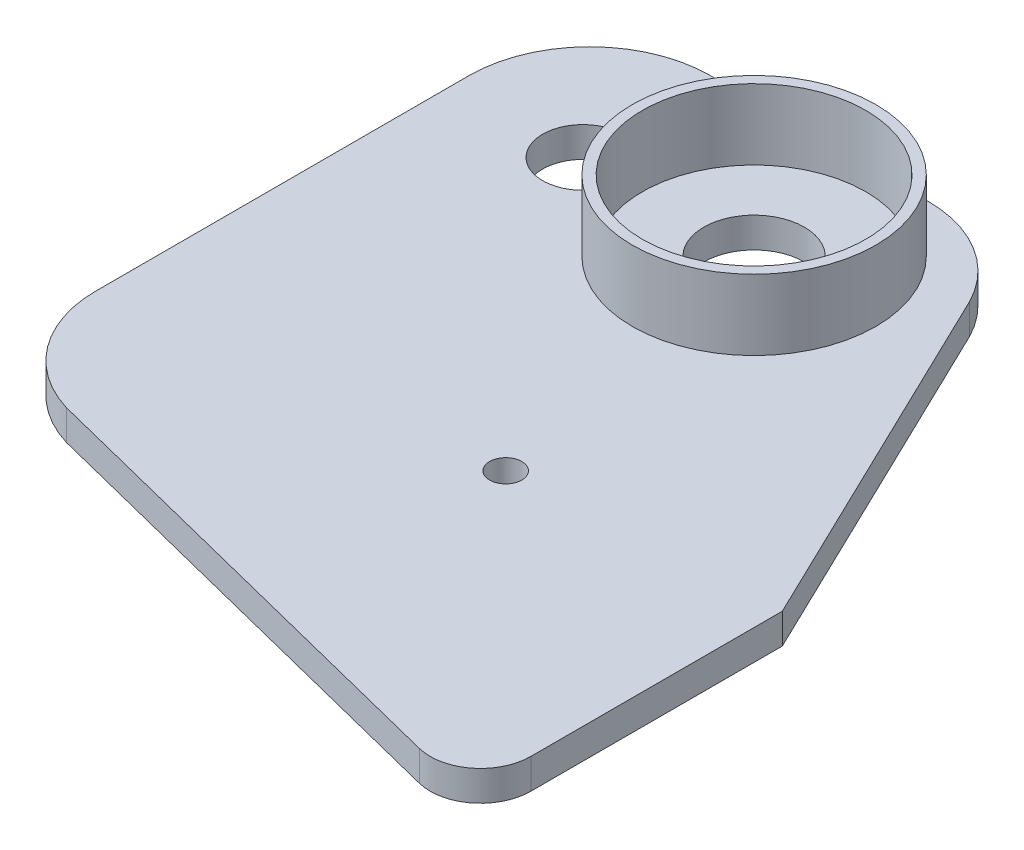
from build123d import *

# Parameters (mm, degrees)
IZIM1_R                     = 1.6
IZIM1_R_2                   = 4
IZIM1_R_3                   = 5
Y_KSEKLIK_EKSTR_ZYON1_DEPTH = 3
IZIM2_R                     = 12.1
IZIM2_R_2                   = 11.1
Y_KSEKLIK_EKSTR_ZYON2_DEPTH = 7
IZIM3_R                     = 1.6
KES_EKSTR_ZYON1_DEPTH       = 82.48402276


with BuildPart() as part:
    # Çizim1 → Yükseklik-Ekstrüzyon1 (new body)
    with BuildSketch(Plane(origin=(0, 0, 0), x_dir=(1, 0, 0), z_dir=(0, 1, 0))):
        with BuildLine():
            Line((50.760204115, 37.614624087), (68.08430001, 1.70394254))
            Line((68.08430001, 1.70394254), (68.084798737, -23.286510722))
            ThreePointArc((68.084798737, -23.286510722), (66.158877099, -27.229964111), (61.864685641, -28.135457628))
            Line((61.864685641, -28.135457628), (14.999890892, -16.342900955))
            ThreePointArc((14.999890892, -16.342900955), (8.811960476, -12.013704596), (6.435524315, -4.845373191))
            Line((6.435524315, -4.845373191), (6.435446445, 1.690953534))
            Line((6.435446445, 1.690953534), (6.435084331, 32.216193937))
            ThreePointArc((6.435084331, 32.216193937), (9.949698543, 40.701509037), (18.434929969, 44.216325258))
            Line((18.434929969, 44.216325258), (40.042732612, 44.21658225))
            ThreePointArc((40.042732612, 44.21658225), (46.336600804, 42.433676297), (50.760204115, 37.614624087))
        make_face()
        with Locations(Location((42.260458863, 0.041620293, 0), (0, 0, 90))):
            Circle(IZIM1_R, mode=Mode.SUBTRACT)
        with Locations(Location((19.13547597, 30.841945567, 0), (0, 0, 90))):
            Circle(IZIM1_R_2, mode=Mode.SUBTRACT)
        with Locations(Location((36.135474475, 30.846047168, 0), (0, 0, 90))):
            Circle(IZIM1_R_3, mode=Mode.SUBTRACT)
    extrude(amount=Y_KSEKLIK_EKSTR_ZYON1_DEPTH)

    # Çizim2 → Yükseklik-Ekstrüzyon2 (add)
    with BuildSketch(Plane(origin=(0, 3, 0), x_dir=(1, 0, 0), z_dir=(0, 1, 0))):
        with Locations(Location((36.135474475, 30.846047168, 0), (0, 0, 90))):
            Circle(IZIM2_R)
        with Locations(Location((36.135474475, 30.846047168, 0), (0, 0, 270))):
            Circle(IZIM2_R_2, mode=Mode.SUBTRACT)
    extrude(amount=Y_KSEKLIK_EKSTR_ZYON2_DEPTH)

    # Çizim3 → Kes-Ekstrüzyon1 (cut, through all)
    with BuildSketch(Plane(origin=(0, 3, 0), x_dir=(1, 0, 0), z_dir=(0, 1, 0))):
        with Locations(Location((22.23883129, 40.216370499, 0), (0, 0, 270))):
            Circle(IZIM3_R)
    extrude(amount=-KES_EKSTR_ZYON1_DEPTH, mode=Mode.SUBTRACT)


solid = part.part
